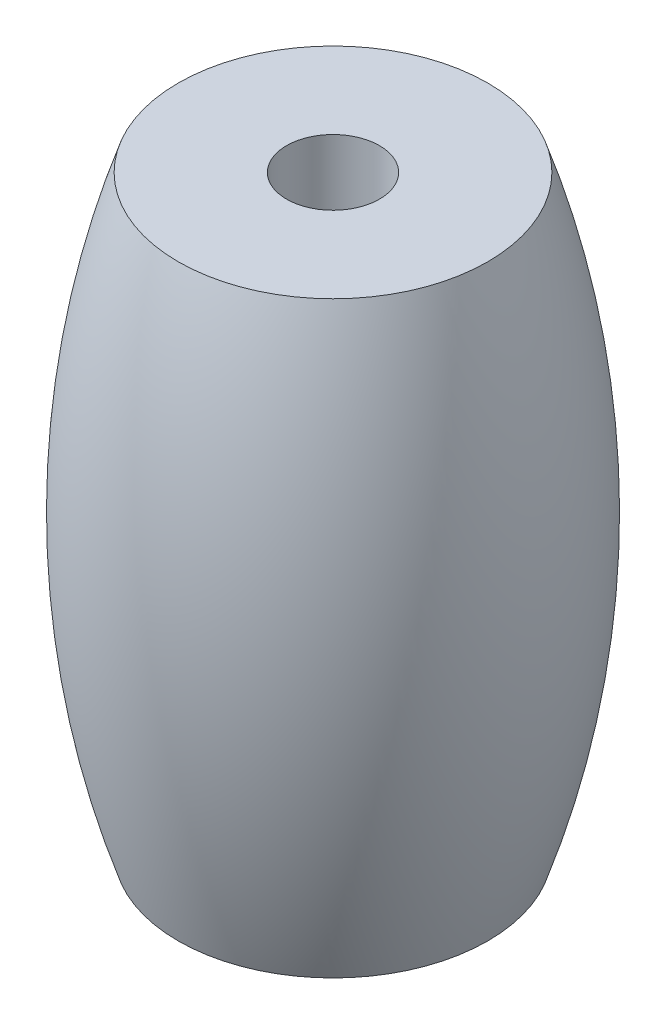
from build123d import *


with BuildPart() as part:
    # 草图1 → 旋转1 (revolve)
    with BuildSketch(Plane.XY, mode=Mode.PRIVATE) as revolve_1_sk:
        with BuildLine():
            Line((-1.5, 16.564395321), (-1.5, -2.435604679))
            Line((-1.5, -2.435604679), (-5, -2.435604679))
            ThreePointArc((-5, -2.435604679), (-6.54389345, 7.064395321), (-5, 16.564395321))
            Line((-5, 16.564395321), (-1.5, 16.564395321))
        make_face()
    revolve(revolve_1_sk.sketch.rotate(Axis((0, 0, 0), (0, 1, 0)), 270), axis=Axis((0, 0, 0), (0, 1, 0)))


solid = part.part
